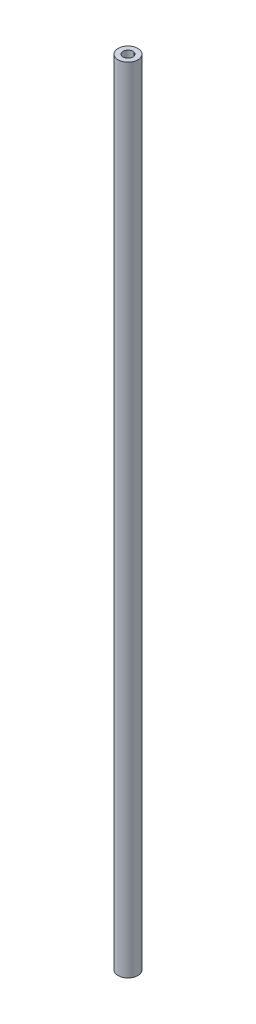
from build123d import *

# Parameters (mm, degrees)
SKETCH1_R           = 1.27
SKETCH1_R_2         = 0.635
BOSS_EXTRUDE1_DEPTH = 101.6


with BuildPart() as part:
    # Sketch1 → Boss-Extrude1 (new body)
    with BuildSketch(Plane(origin=(0, 0, 0), x_dir=(1, 0, 0), z_dir=(0, 1, 0))):
        with Locations(Location((0, 0, 0), (0, 0, 270))):
            Circle(SKETCH1_R)
        with Locations(Location((0, 0, 0), (0, 0, 270))):
            Circle(SKETCH1_R_2, mode=Mode.SUBTRACT)
    extrude(amount=BOSS_EXTRUDE1_DEPTH)


solid = part.part
